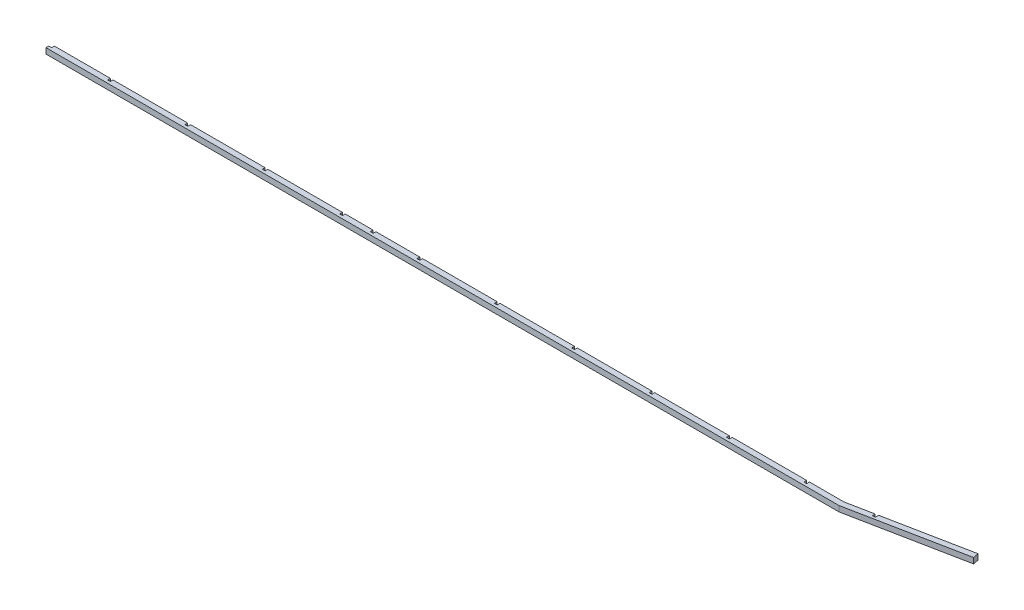
from build123d import *

# Parameters (mm, degrees)
BOSS_EXTRUDE1_DEPTH = 6


with BuildPart() as part:
    # Sketch1 → Boss-Extrude1 (new body)
    with BuildSketch(Plane(origin=(0, 0, 0), x_dir=(1, 0, 0), z_dir=(0, 1, 0))):
        Polygon((0, 0), (3, 0), (3, 3), (63, 3), (63, 0), (66, 0), (66, 3), (146, 3), (146, 0), (149, 0), (149, 3), (229, 3), (229, 0), (232, 0), (232, 3), (312, 3), (312, 0), (315, 0), (315, 3), (345, 3), (345, 0), (348, 0), (348, 3), (395, 3), (395, 0), (398, 0), (398, 3), (478, 3), (478, 0), (481, 0), (481, 3), (561, 3), (561, 0), (564, 0), (564, 3), (644, 3), (644, 0), (647, 0), (647, 3), (727, 3), (727, 0), (730, 0), (730, 3), (810, 3), (810, 0), (813, 0), (813, 3), (850, 3), (878, 8.546407108), (878, 5.546407108), (881, 5.546407108), (881, 9.140665012), (970, 26.770316177), (971.165862794, 20.88467569), (850.588540161, -3), (0, -3), align=None)
    extrude(amount=BOSS_EXTRUDE1_DEPTH)


solid = part.part
